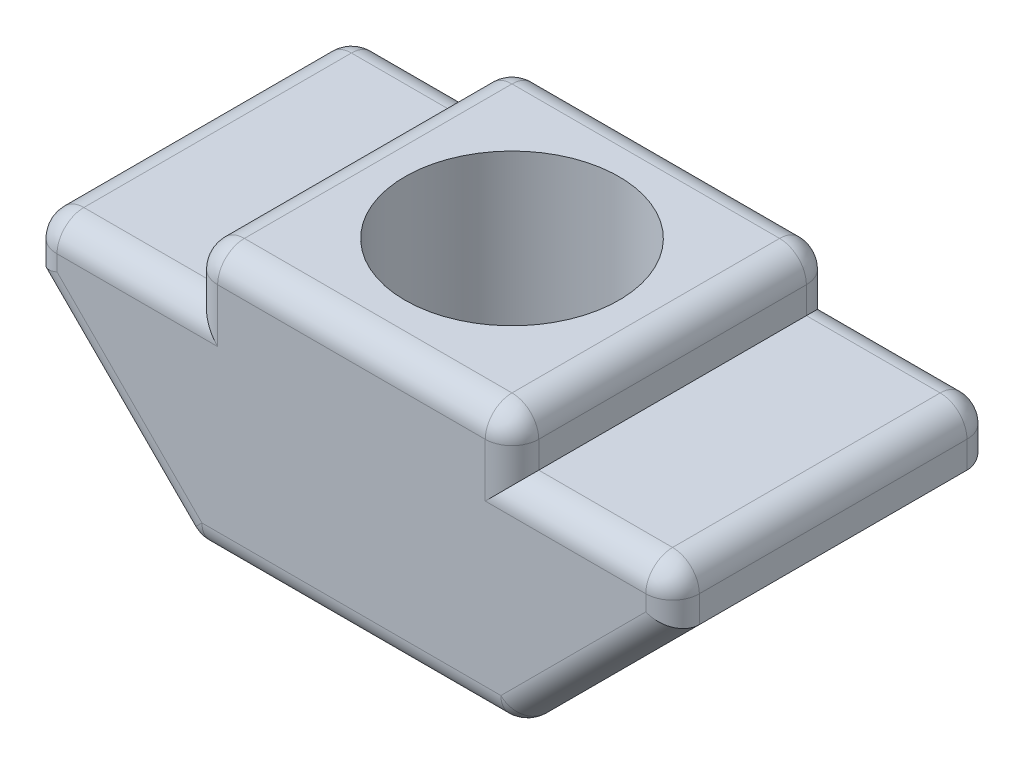
from build123d import *

# Parameters (mm, degrees)
BOSS_EXTRUDE1_DEPTH = 6
FILLET1_R           = 0.5
SKETCH2_R           = 2
CUT_EXTRUDE1_DEPTH  = 12.916375288


with BuildPart() as part:
    # Sketch1 → Boss-Extrude1 (new body)
    with BuildSketch(Plane.XY):
        Polygon((0, 0), (6, 0), (9, 3), (9, 4), (6, 4), (6, 5), (0, 5), (0, 4), (-3, 4), (-3, 3), align=None)
    extrude(amount=BOSS_EXTRUDE1_DEPTH)

    # Fillet1
    fillet1_edges = [part.edges().sort_by_distance(p)[0] for p in [
        (7.5, 1.5, 6),
        (0, 4.5, 0),
        (3, 5, 0),
        (6, 4.5, 0),
        (7.5, 4, 0),
        (9, 3.5, 0),
        (7.5, 1.5, 0),
        (3, 0, 0),
        (-1.5, 1.5, 0),
        (9, 3.5, 6),
        (7.5, 4, 6),
        (-3, 4, 3),
        (0, 5, 3),
        (6, 5, 3),
        (9, 4, 3),
        (6, 0, 3),
        (0, 0, 3),
        (6, 4.5, 6),
        (3, 5, 6),
        (0, 4.5, 6),
        (-1.5, 4, 6),
        (-3, 3.5, 6),
        (-1.5, 1.5, 6),
        (3, 0, 6),
        (-3, 3.5, 0),
        (-1.5, 4, 0),
    ]]
    fillet(fillet1_edges, radius=FILLET1_R)

    # Sketch2 → Cut-Extrude1 (cut, through all)
    with BuildSketch(Plane(origin=(0, 5, 0), x_dir=(1, 0, 0), z_dir=(0, 1, 0))):
        with Locations(Location((3, -3, 0), (0, 0, 270))):
            Circle(SKETCH2_R)
    extrude(amount=-CUT_EXTRUDE1_DEPTH, mode=Mode.SUBTRACT)


solid = part.part
